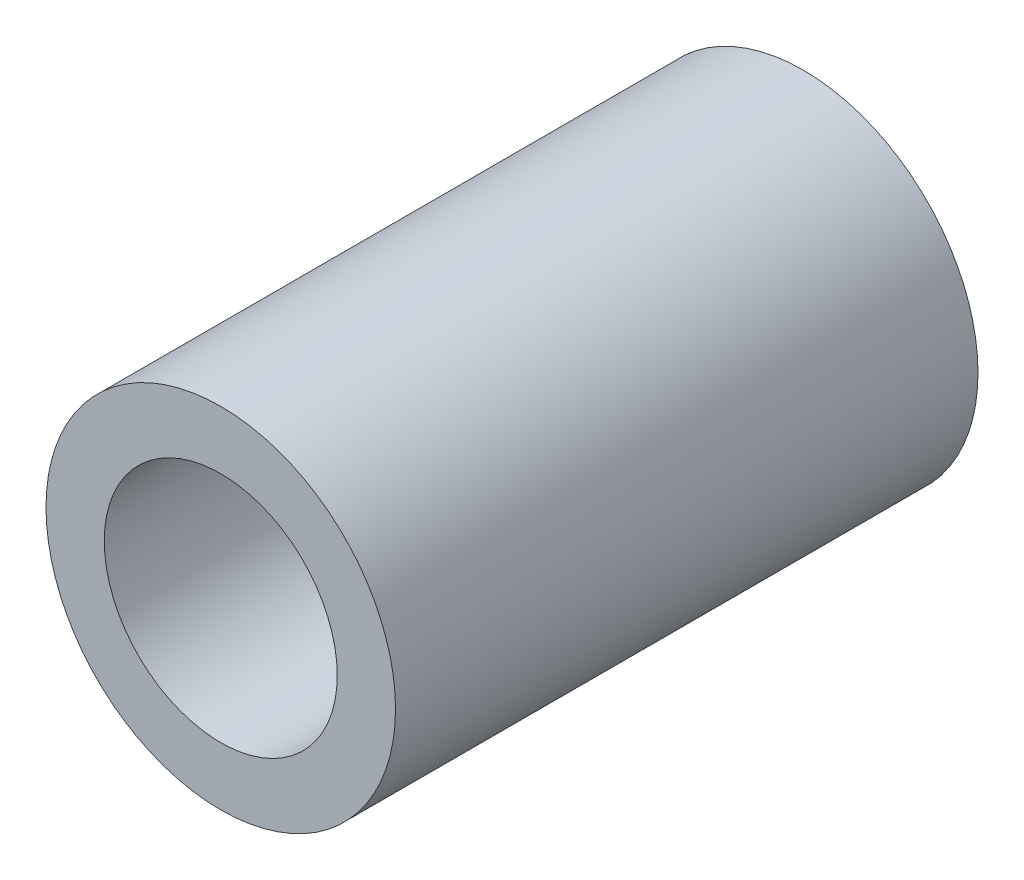
from build123d import *

# Parameters (mm, degrees)
SKETCH_1_R      = 3
SKETCH_1_R_2    = 2
EXTRUDE_1_DEPTH = 5


with BuildPart() as part:
    # 草图1 → 凸台-拉伸1 (new, symmetric)
    with BuildSketch(Plane.XY):
        Circle(SKETCH_1_R)
        Circle(SKETCH_1_R_2, mode=Mode.SUBTRACT)
    extrude(amount=EXTRUDE_1_DEPTH, both=True)


solid = part.part
